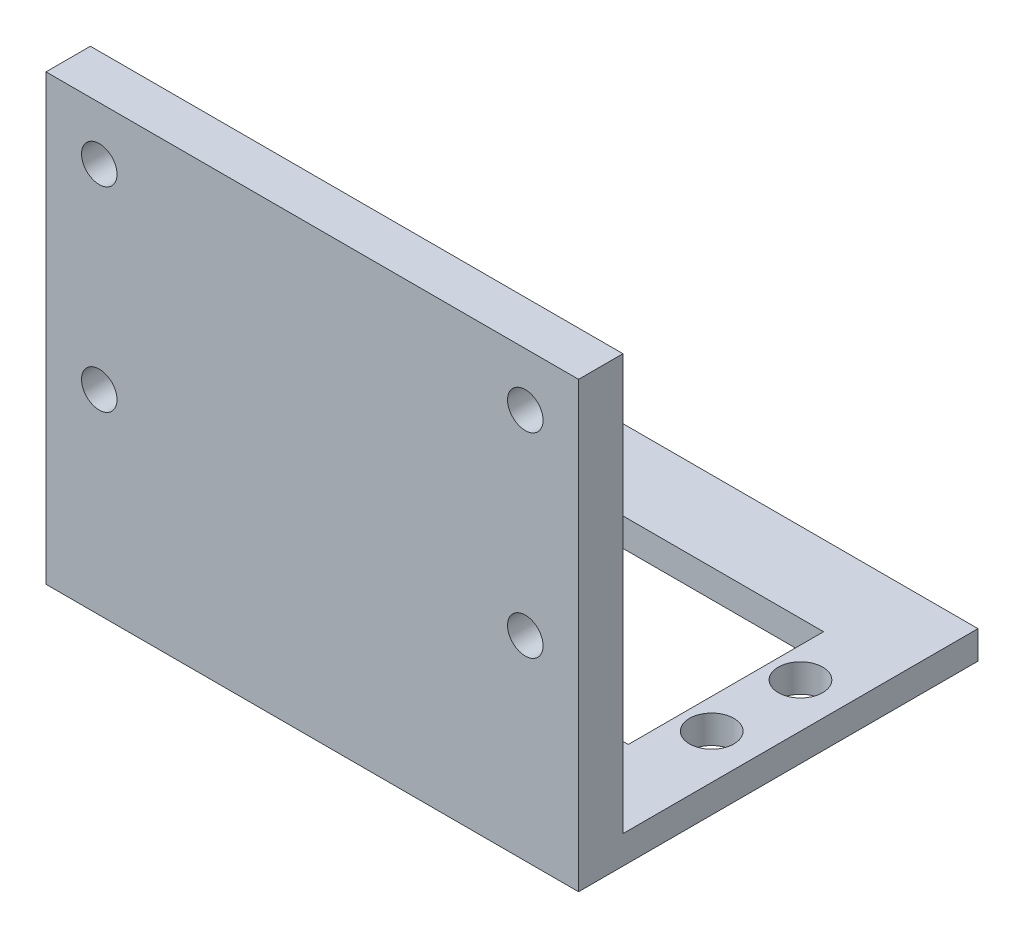
from build123d import *

# Parameters (mm, degrees)
SKETCH1_W             = 60
SKETCH1_H             = 40
SKETCH1_R             = 2.5
SKETCH1_W_2           = 42
SKETCH1_H_2           = 22
BOSS_EXTRUDE1_DEPTH   = 3.175
SKETCH2_W             = 60
SKETCH2_H             = 50
BOSS_EXTRUDE2_DEPTH   = 5
F_4_0MM_DOWEL_HOLE1_D = 4


with BuildPart() as part:
    # Sketch1 → Boss-Extrude1 (new body)
    with BuildSketch(Plane(origin=(0, 0, 0), x_dir=(1, 0, 0), z_dir=(0, 1, 0))):
        Rectangle(SKETCH1_W, SKETCH1_H)
        with Locations(Location((25, 5, 0), (0, 0, 270))):
            Circle(SKETCH1_R, mode=Mode.SUBTRACT)
        with Locations(Location((-23.8, 5, 0), (0, 0, 270))):
            Circle(SKETCH1_R, mode=Mode.SUBTRACT)
        with Locations(Location((-23.8, -5, 0), (0, 0, 270))):
            Circle(SKETCH1_R, mode=Mode.SUBTRACT)
        with Locations(Location((25, -5, 0), (0, 0, 270))):
            Circle(SKETCH1_R, mode=Mode.SUBTRACT)
        with Locations((0.6, 0)):
            Rectangle(SKETCH1_W_2, SKETCH1_H_2, mode=Mode.SUBTRACT)
    extrude(amount=BOSS_EXTRUDE1_DEPTH)

    # Sketch2 → Boss-Extrude2 (add)
    with BuildSketch(Plane.XY.offset(20)):
        with Locations((0, 25)):
            Rectangle(SKETCH2_W, SKETCH2_H)
    extrude(amount=BOSS_EXTRUDE2_DEPTH)

    # Ø4.0mm Dowel Hole1 (through all)
    with Locations(Plane(origin=(0, 0, 20), x_dir=(-1, 0, 0), z_dir=(0, 0, -1))):
        with Locations((-24, 44), (24, 44), (-24, 22), (24, 22)):
            Hole(F_4_0MM_DOWEL_HOLE1_D / 2)


solid = part.part
